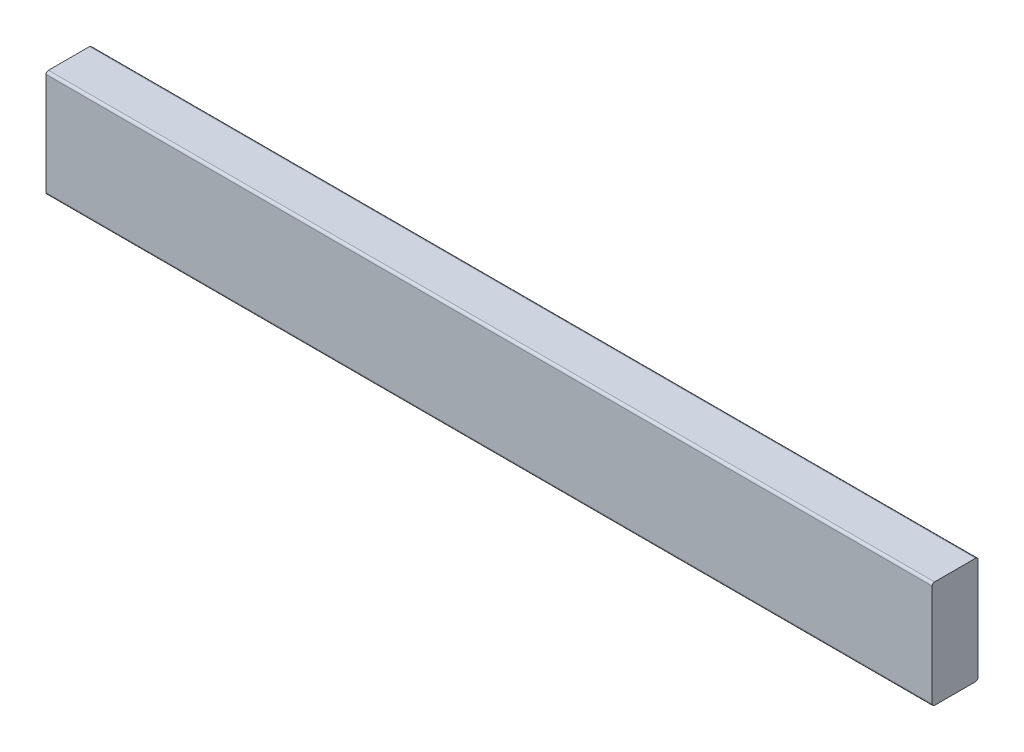
from build123d import *

# Parameters (mm, degrees)
SKETCH1_W           = 88.9
SKETCH1_H           = 38.1
BOSS_EXTRUDE1_DEPTH = 736.6
FILLET1_R           = 2


with BuildPart() as part:
    # Sketch1 → Boss-Extrude1 (new body)
    with BuildSketch(Plane(origin=(0, 0, 0), x_dir=(0, -1, 0), z_dir=(1, 0, 0))):
        Rectangle(SKETCH1_W, SKETCH1_H)
    extrude(amount=BOSS_EXTRUDE1_DEPTH)

    # Fillet1
    fillet1_edges = [part.edges().sort_by_distance(p)[0] for p in [
        (368.3, -44.45, 19.05),
        (368.3, 44.45, 19.05),
        (368.3, 44.45, -19.05),
        (368.3, -44.45, -19.05),
    ]]
    fillet(fillet1_edges, radius=FILLET1_R)


solid = part.part
